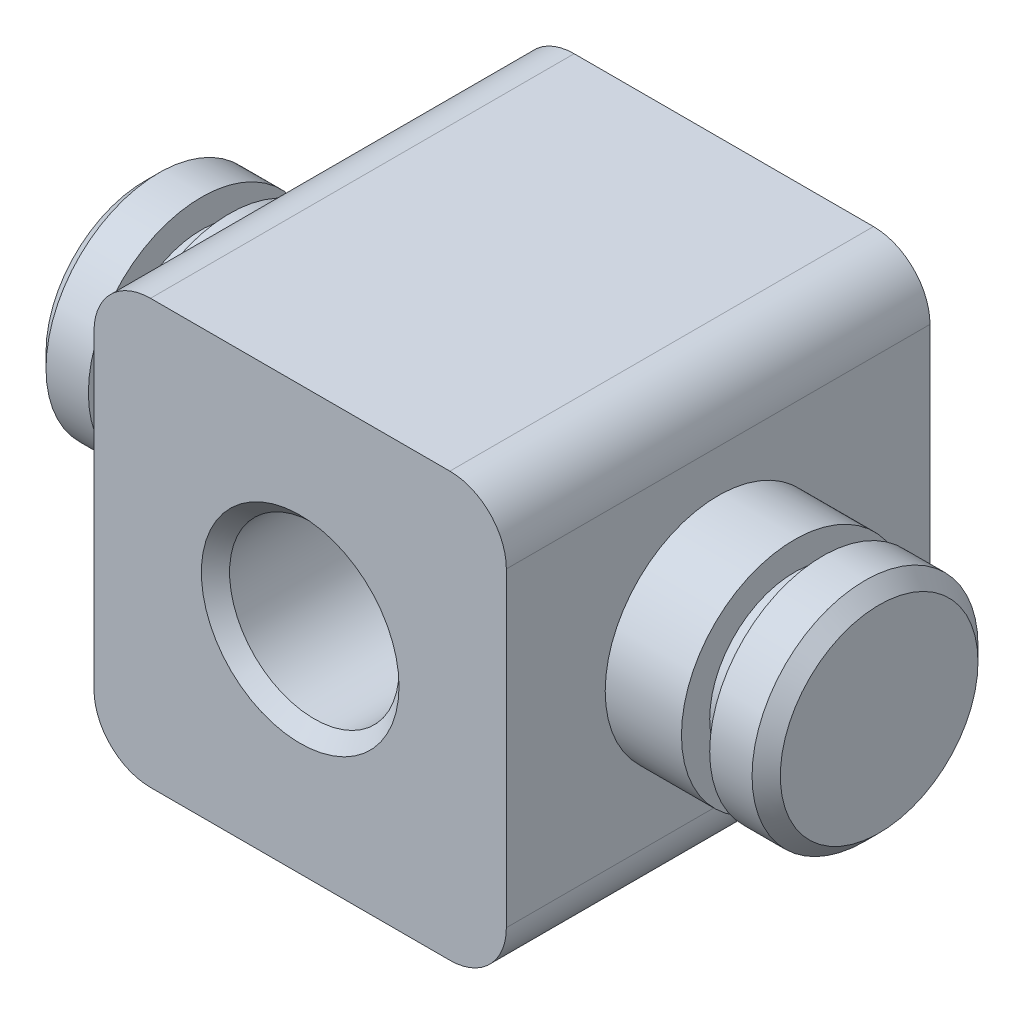
from build123d import *

# Parameters (mm, degrees)
SKETCH1_R                = 3
BOSS_EXTRUDE1_DEPTH      = 15
SKETCH2_R                = 4
BOSS_EXTRUDE2_DEPTH      = 2.7
SKETCH3_R                = 3
BOSS_EXTRUDE3_DEPTH      = 1
SKETCH4_R                = 4
BOSS_EXTRUDE4_DEPTH      = 2
CHAMFER1_SIZE            = 0.5
CHAMFER1_OF_MIRROR1_SIZE = 0.5
CHAMFER2_SIZE            = 0.5


with BuildPart() as part:
    # Sketch1 → Boss-Extrude1 (new body)
    with BuildSketch(Plane.XY):
        with BuildLine():
            Line((-5.3, -7.5), (5.3, -7.5))
            ThreePointArc((5.3, -7.5), (6.714213562, -6.914213562), (7.3, -5.5))
            Line((7.3, -5.5), (7.3, 5.5))
            ThreePointArc((7.3, 5.5), (6.714213562, 6.914213562), (5.3, 7.5))
            Line((5.3, 7.5), (-5.3, 7.5))
            ThreePointArc((-5.3, 7.5), (-6.714213562, 6.914213562), (-7.3, 5.5))
            Line((-7.3, 5.5), (-7.3, -5.5))
            ThreePointArc((-7.3, -5.5), (-6.714213562, -6.914213562), (-5.3, -7.5))
        make_face()
        Circle(SKETCH1_R, mode=Mode.SUBTRACT)
    extrude(amount=BOSS_EXTRUDE1_DEPTH)

    # Sketch2 → Boss-Extrude2 (add)
    with BuildSketch(Plane.ZY.offset(7.3)):
        with Locations(Location((7.5, 0, 0), (0, 0, 180))):
            Circle(SKETCH2_R)
    boss_extrude2 = extrude(amount=BOSS_EXTRUDE2_DEPTH)

    # Sketch3 → Boss-Extrude3 (add)
    with BuildSketch(Plane.ZY.offset(10)):
        with Locations((7.5, 0)):
            Circle(SKETCH3_R)
    boss_extrude3 = extrude(amount=BOSS_EXTRUDE3_DEPTH)

    # Sketch4 → Boss-Extrude4 (add)
    with BuildSketch(Plane.ZY.offset(11)):
        with Locations(Location((7.5, 0, 0), (0, 0, 180))):
            Circle(SKETCH4_R)
    boss_extrude4 = extrude(amount=BOSS_EXTRUDE4_DEPTH)

    # Chamfer1
    chamfer1_edges = [part.edges().sort_by_distance(p)[0] for p in [
        (-13, 0, 11.5),
    ]]
    chamfer(chamfer1_edges, length=CHAMFER1_SIZE)

    # Mirror1: Boss-Extrude2, Boss-Extrude3, Boss-Extrude4 across plane
    add(boss_extrude2.mirror(Plane(origin=(0, 0, 0), x_dir=(0, 0, 1), z_dir=(1, 0, 0))))
    add(boss_extrude3.mirror(Plane(origin=(0, 0, 0), x_dir=(0, 0, 1), z_dir=(1, 0, 0))))
    add(boss_extrude4.mirror(Plane(origin=(0, 0, 0), x_dir=(0, 0, 1), z_dir=(1, 0, 0))))

    # Chamfer1 of Mirror1
    chamfer1_of_mirror1_edges = [part.edges().sort_by_distance(p)[0] for p in [
        (13, 0, 11.5),
    ]]
    chamfer(chamfer1_of_mirror1_edges, length=CHAMFER1_OF_MIRROR1_SIZE)

    # Chamfer2
    chamfer2_edges = [part.edges().sort_by_distance(p)[0] for p in [
        (-3, 0, 0),
        (-3, 0, 15),
    ]]
    chamfer(chamfer2_edges, length=CHAMFER2_SIZE)


solid = part.part
